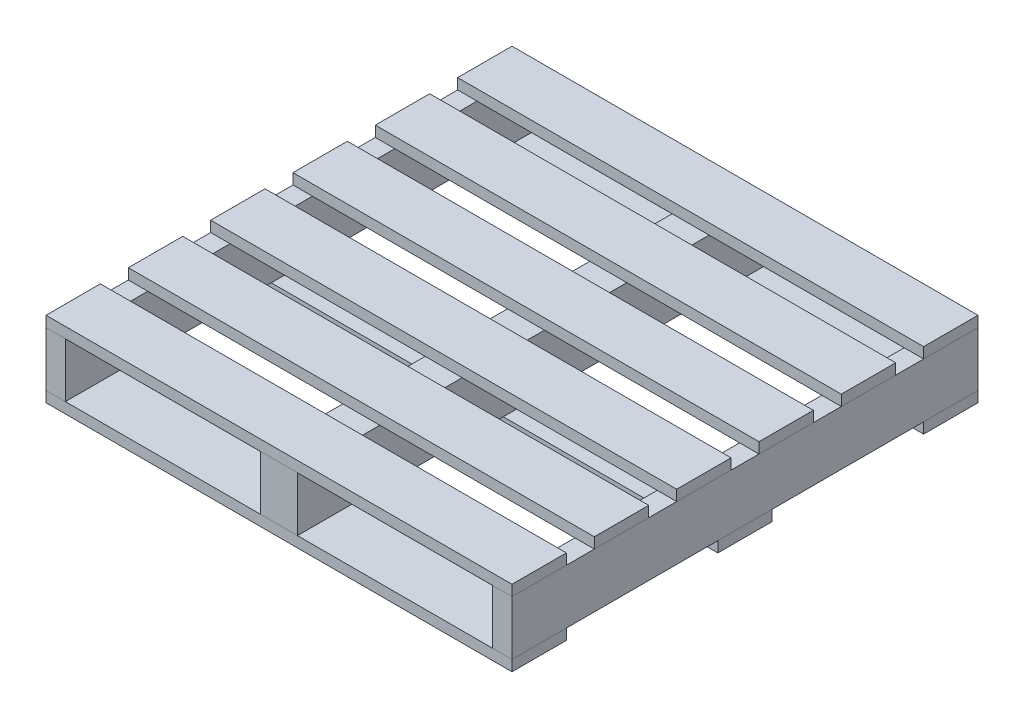
from build123d import *

# Parameters (mm, degrees)
BOSS_EXTRUDE1_DEPTH        = 381
BOSS_EXTRUDE1_DEPTH_BACK   = 381
SKETCH3_W                  = 31.75
SKETCH3_H                  = 89.0016
BOSS_EXTRUDE1_2_DEPTH      = 381
BOSS_EXTRUDE1_2_DEPTH_BACK = 381
SKETCH3_W_2                = 60.452
BOSS_EXTRUDE1_3_DEPTH      = 381
BOSS_EXTRUDE1_3_DEPTH_BACK = 381
SKETCH4_W                  = 762
SKETCH4_H                  = 88.9
BOSS_EXTRUDE2_DEPTH        = 17.4752
BOSS_EXTRUDE2_2_DEPTH      = 17.4752
BOSS_EXTRUDE2_3_DEPTH      = 17.4752
BOSS_EXTRUDE2_4_DEPTH      = 17.4752
BOSS_EXTRUDE2_5_DEPTH      = 17.4752
BOSS_EXTRUDE2_6_DEPTH      = 17.4752
SKETCH5_W                  = 762
SKETCH5_H                  = 88.9
BOSS_EXTRUDE3_DEPTH        = 17.4752
BOSS_EXTRUDE3_2_DEPTH      = 17.4752
BOSS_EXTRUDE3_3_DEPTH      = 17.4752


with BuildPart() as part:
    # Sketch3 → Boss-Extrude1 (new, two sides: drawn at the far end of the back side and taken through both)
    with BuildSketch(Plane.XY.offset(-BOSS_EXTRUDE1_DEPTH_BACK)):
        with Locations((-365.125, 0)):
            Rectangle(SKETCH3_W, SKETCH3_H)
    extrude(amount=BOSS_EXTRUDE1_DEPTH + BOSS_EXTRUDE1_DEPTH_BACK)


with BuildPart() as body_2:
    # Sketch3 → Boss-Extrude1 2 (new, two sides: drawn at the far end of the back side and taken through both)
    with BuildSketch(Plane.XY.offset(-BOSS_EXTRUDE1_2_DEPTH_BACK)):
        Rectangle(SKETCH3_W_2, SKETCH3_H)
    extrude(amount=BOSS_EXTRUDE1_2_DEPTH + BOSS_EXTRUDE1_2_DEPTH_BACK)


with BuildPart() as body_3:
    # Sketch3 → Boss-Extrude1 3 (new, two sides: drawn at the far end of the back side and taken through both)
    with BuildSketch(Plane.XY.offset(-BOSS_EXTRUDE1_3_DEPTH_BACK)):
        with Locations((365.125, 0)):
            Rectangle(SKETCH3_W, SKETCH3_H)
    extrude(amount=BOSS_EXTRUDE1_3_DEPTH + BOSS_EXTRUDE1_3_DEPTH_BACK)


with BuildPart() as body_4:
    # Sketch4 → Boss-Extrude2 (new body)
    with BuildSketch(Plane(origin=(0, 44.5008, 0), x_dir=(1, 0, 0), z_dir=(0, 1, 0))):
        with Locations((0, -336.55)):
            Rectangle(SKETCH4_W, SKETCH4_H)
    extrude(amount=BOSS_EXTRUDE2_DEPTH)


with BuildPart() as body_5:
    # Sketch4 → Boss-Extrude2 2 (new body)
    with BuildSketch(Plane(origin=(0, 44.5008, 0), x_dir=(1, 0, 0), z_dir=(0, 1, 0))):
        with Locations((0, -201.93)):
            Rectangle(SKETCH4_W, SKETCH4_H)
    extrude(amount=BOSS_EXTRUDE2_2_DEPTH)


with BuildPart() as body_6:
    # Sketch4 → Boss-Extrude2 3 (new body)
    with BuildSketch(Plane(origin=(0, 44.5008, 0), x_dir=(1, 0, 0), z_dir=(0, 1, 0))):
        with Locations((0, -67.31)):
            Rectangle(SKETCH4_W, SKETCH4_H)
    extrude(amount=BOSS_EXTRUDE2_3_DEPTH)


with BuildPart() as body_7:
    # Sketch4 → Boss-Extrude2 4 (new body)
    with BuildSketch(Plane(origin=(0, 44.5008, 0), x_dir=(1, 0, 0), z_dir=(0, 1, 0))):
        with Locations((0, 67.31)):
            Rectangle(SKETCH4_W, SKETCH4_H)
    extrude(amount=BOSS_EXTRUDE2_4_DEPTH)


with BuildPart() as body_8:
    # Sketch4 → Boss-Extrude2 5 (new body)
    with BuildSketch(Plane(origin=(0, 44.5008, 0), x_dir=(1, 0, 0), z_dir=(0, 1, 0))):
        with Locations((0, 201.93)):
            Rectangle(SKETCH4_W, SKETCH4_H)
    extrude(amount=BOSS_EXTRUDE2_5_DEPTH)


with BuildPart() as body_9:
    # Sketch4 → Boss-Extrude2 6 (new body)
    with BuildSketch(Plane(origin=(0, 44.5008, 0), x_dir=(1, 0, 0), z_dir=(0, 1, 0))):
        with Locations((0, 336.55)):
            Rectangle(SKETCH4_W, SKETCH4_H)
    extrude(amount=BOSS_EXTRUDE2_6_DEPTH)


with BuildPart() as body_10:
    # Sketch5 → Boss-Extrude3 (new body)
    with BuildSketch(Plane.XZ.offset(44.5008)):
        with Locations((0, 336.55)):
            Rectangle(SKETCH5_W, SKETCH5_H)
    extrude(amount=BOSS_EXTRUDE3_DEPTH)


with BuildPart() as body_11:
    # Sketch5 → Boss-Extrude3 2 (new body)
    with BuildSketch(Plane.XZ.offset(44.5008)):
        with Locations((0, -336.55)):
            Rectangle(SKETCH5_W, SKETCH5_H)
    extrude(amount=BOSS_EXTRUDE3_2_DEPTH)


with BuildPart() as body_12:
    # Sketch5 → Boss-Extrude3 3 (new body)
    with BuildSketch(Plane.XZ.offset(44.5008)):
        Rectangle(SKETCH5_W, SKETCH5_H)
    extrude(amount=BOSS_EXTRUDE3_3_DEPTH)


solid = Compound([part.part, body_2.part, body_3.part, body_4.part, body_5.part, body_6.part, body_7.part, body_8.part, body_9.part, body_10.part, body_11.part, body_12.part])
